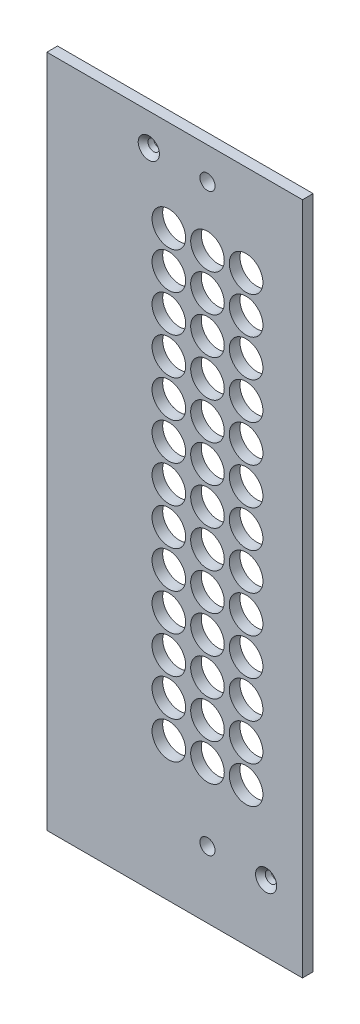
from build123d import *

# Parameters (mm, degrees)
SKETCH1_W                                       = 56.55
SKETCH1_H                                       = 197.425
BOSS_EXTRUDE1_DEPTH                             = 3.175
SKETCH4_R                                       = 5
CUT_EXTRUDE2_DEPTH                              = 103.731270343
LPATTERN3_COUNT                                 = 13
LPATTERN3_PITCH                                 = 11
SKETCH5_W                                       = 3.175
SKETCH5_H                                       = 197.425
BOSS_EXTRUDE2_DEPTH                             = 19.525
SKETCH14_W                                      = 76.075
SKETCH14_H                                      = 3.175
BOSS_EXTRUDE3_DEPTH                             = 3.175
M4_CLEARANCE_HOLE1_D                            = 4.5
CSK_FOR_M3_FLAT_HEAD_MACHINE_SCREW4_D           = 3.4
CSK_FOR_M3_FLAT_HEAD_MACHINE_SCREW4_CSINK_D     = 6.3
CSK_FOR_M3_FLAT_HEAD_MACHINE_SCREW4_CSINK_ANGLE = 90


with BuildPart() as part:
    # Sketch1 → Boss-Extrude1 (new body)
    with BuildSketch(Plane.XY):
        Rectangle(SKETCH1_W, SKETCH1_H)
    extrude(amount=BOSS_EXTRUDE1_DEPTH)

    # Sketch4 → Cut-Extrude2 (cut, through all)
    with BuildSketch(Plane.XY.offset(3.175)):
        with Locations((0, -57.369162839)):
            Circle(SKETCH4_R)
        with Locations((11.5, -57.369162839)):
            Circle(SKETCH4_R)
        with Locations((-11.5, -57.369162839)):
            Circle(SKETCH4_R)
    cut_extrude2 = extrude(amount=-CUT_EXTRUDE2_DEPTH, mode=Mode.SUBTRACT)

    # LPattern3: Cut-Extrude2 ×13
    with Locations(*[(0, i * LPATTERN3_PITCH, 0) for i in range(1, LPATTERN3_COUNT)]):
        add(cut_extrude2, mode=Mode.SUBTRACT)

    # Sketch5 → Boss-Extrude2 (add)
    with BuildSketch(Plane.ZY.offset(28.275)):
        with Locations((1.5875, 0)):
            Rectangle(SKETCH5_W, SKETCH5_H)
    extrude(amount=BOSS_EXTRUDE2_DEPTH)

    # Sketch14 → Boss-Extrude3 (add)
    with BuildSketch(Plane(origin=(0, 98.7125, 0), x_dir=(1, 0, 0), z_dir=(0, 1, 0))):
        with Locations((-9.7625, -1.5875)):
            Rectangle(SKETCH14_W, SKETCH14_H)
    extrude(amount=BOSS_EXTRUDE3_DEPTH)

    # M4 Clearance Hole1 (through all)
    with Locations(Plane.XY.offset(3.175)):
        with Locations((0, 92.3625001), (0, -78.8874999)):
            Hole(M4_CLEARANCE_HOLE1_D / 2)

    # CSK for M3 Flat Head Machine Screw4 (through all)
    with Locations(Plane.XY.offset(3.175)):
        with Locations((17.4625, -78.8874999), (-17.4625, 92.3625001)):
            CounterSinkHole(CSK_FOR_M3_FLAT_HEAD_MACHINE_SCREW4_D / 2, CSK_FOR_M3_FLAT_HEAD_MACHINE_SCREW4_CSINK_D / 2, counter_sink_angle=CSK_FOR_M3_FLAT_HEAD_MACHINE_SCREW4_CSINK_ANGLE)


solid = part.part
